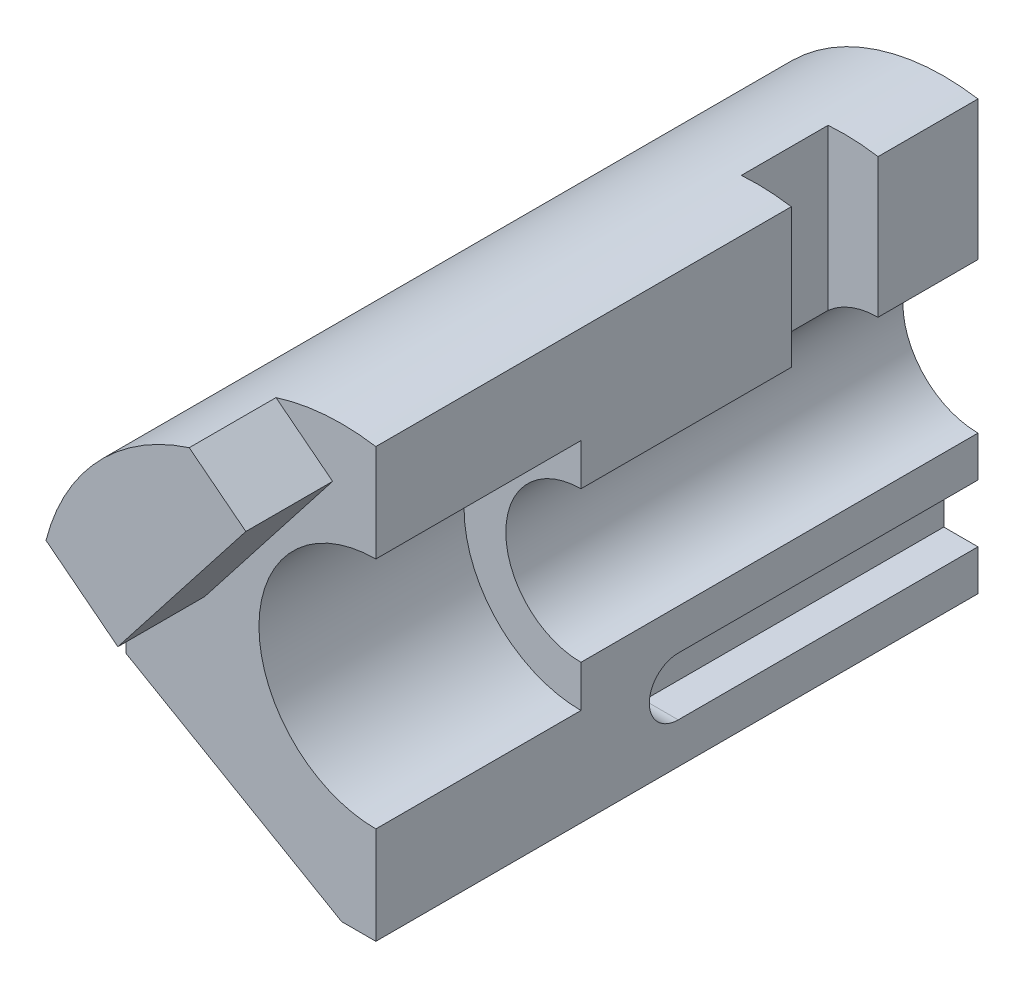
from build123d import *

# Parameters (mm, degrees)
BOSS_EXTRUDE1_DEPTH     = 229
SKETCH2_R               = 44.45
CUT_EXTRUDE1_DEPTH      = 78
SKETCH3_R               = 28.575
CUT_EXTRUDE2_DEPTH      = 243.326226397
CUT_EXTRUDE3_DEPTH      = 13
BOSS_EXTRUDE2_DEPTH     = 33
CUT_EXTRUDE4_REACH      = 325.365
CUT_EXTRUDE4_END_RADIUS = 28.575
SKETCH7_W               = 19
SKETCH7_H               = 33


with BuildPart() as part:
    # Sketch1 → Boss-Extrude1 (new body)
    with BuildSketch(Plane.XY):
        with BuildLine():
            Line((0, 0), (-13, 0))
            Line((-13, 0), (-95, 47.342722074))
            Line((-95, 47.342722074), (-95, 82))
            ThreePointArc((-95, 82), (-66.188344588, 144.409935107), (0, 162.962954492))
            Line((0, 162.962954492), (0, 0))
        make_face()
    extrude(amount=BOSS_EXTRUDE1_DEPTH)

    # Sketch2 → Cut-Extrude1 (cut)
    with BuildSketch(Plane.XY.offset(229)):
        with Locations((0, 81.481477246)):
            Circle(SKETCH2_R)
    extrude(amount=-CUT_EXTRUDE1_DEPTH, mode=Mode.SUBTRACT)

    # Sketch3 → Cut-Extrude2 (cut, through all)
    with BuildSketch(Plane.XY.offset(151)):
        with Locations((0, 81.481477246)):
            Circle(SKETCH3_R)
    extrude(amount=-CUT_EXTRUDE2_DEPTH, mode=Mode.SUBTRACT)

    # Sketch4 → Cut-Extrude3 (cut)
    with BuildSketch(Plane(origin=(0, 0, 0), x_dir=(0, 0, -1), z_dir=(1, 0, 0))):
        with BuildLine():
            Line((0, 15.453238623), (-114, 15.453238623))
            ThreePointArc((-114, 15.453238623), (-125, 26.453238623), (-114, 37.453238623))
            Line((-114, 37.453238623), (0, 37.453238623))
            ThreePointArc((0, 37.453238623), (11, 26.453238623), (0, 15.453238623))
        make_face()
    extrude(amount=-CUT_EXTRUDE3_DEPTH, mode=Mode.SUBTRACT)

    # Sketch5 → Boss-Extrude2 (add)
    with BuildSketch(Plane.XY.offset(229)):
        with BuildLine():
            Line((-37.972309742, 160.104953404), (-16.437525278, 143.280135832))
            Line((-16.437525278, 143.280135832), (-65.108558458, 80.984054183))
            Line((-65.108558458, 80.984054183), (-92.438236004, 102.336338426))
            ThreePointArc((-92.438236004, 102.336338426), (-72.663168997, 138.25216676), (-37.972309742, 160.104953404))
        make_face()
    extrude(amount=BOSS_EXTRUDE2_DEPTH)

    # Cut-Extrude4: up to this cylinder (the profile starts outside it)
    cut_extrude4_end = Plane(origin=(0, 81.481477246, 54.5), z_dir=(0, 0, 1)) * Cylinder(CUT_EXTRUDE4_END_RADIUS, 708.88, mode=Mode.PRIVATE)
    # Sketch7 → Cut-Extrude4 (cut, up to the surface)
    with BuildSketch(Plane(origin=(0, 164, 0), x_dir=(1, 0, 0), z_dir=(0, 1, 0)), mode=Mode.PRIVATE) as cut_extrude4_sk1:
        with Locations((-9.5, -54.5)):
            Rectangle(SKETCH7_W, SKETCH7_H)
    cut_extrude4_tool1 = extrude(cut_extrude4_sk1.sketch, amount=-CUT_EXTRUDE4_REACH, mode=Mode.PRIVATE) - cut_extrude4_end
    add(cut_extrude4_tool1.solids().sort_by_distance((-9.5, 164, 54.5))[0], mode=Mode.SUBTRACT)


solid = part.part
